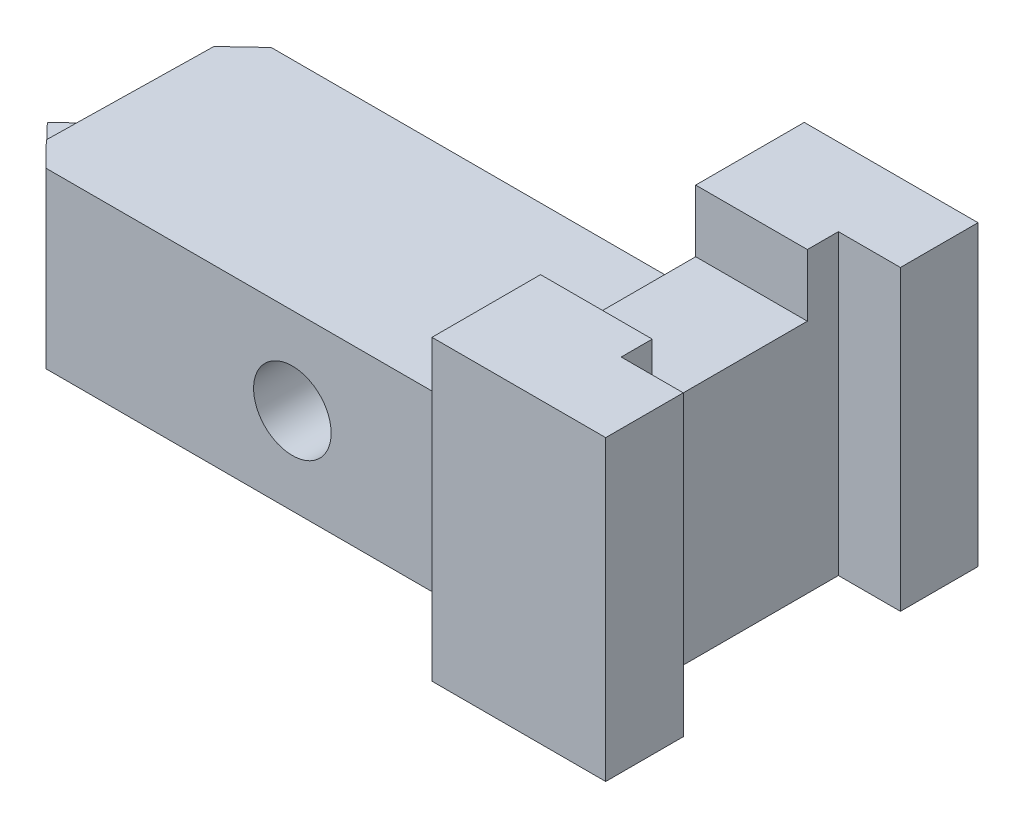
from build123d import *

# Parameters (mm, degrees)
SKETCH1_W           = 28
SKETCH1_H           = 48
BOSS_EXTRUDE3_DEPTH = 60
SKETCH6_W           = 10
SKETCH6_H           = 35
CUT_EXTRUDE7_DEPTH  = 48
SKETCH7_W           = 25
SKETCH7_H           = 10
CUT_EXTRUDE8_DEPTH  = 48
SKETCH8_W           = 35
SKETCH8_H           = 28
BOSS_EXTRUDE4_DEPTH = 92
SKETCH9_R           = 6.25
CUT_EXTRUDE9_DEPTH  = 59
CUT_EXTRUDE12_DEPTH = 59
CUT_EXTRUDE13_DEPTH = 59
CUT_EXTRUDE18_DEPTH = 11


with BuildPart() as part:
    # Sketch1 → Boss-Extrude3 (new body)
    with BuildSketch(Plane.XY):
        with Locations((14, 24)):
            Rectangle(SKETCH1_W, SKETCH1_H)
    extrude(amount=BOSS_EXTRUDE3_DEPTH)

    # Sketch6 → Cut-Extrude7 (cut)
    with BuildSketch(Plane(origin=(0, 48, 0), x_dir=(1, 0, 0), z_dir=(0, 1, 0))):
        with Locations((23, -30)):
            Rectangle(SKETCH6_W, SKETCH6_H)
    extrude(amount=-CUT_EXTRUDE7_DEPTH, mode=Mode.SUBTRACT)

    # Sketch7 → Cut-Extrude8 (cut)
    with BuildSketch(Plane.ZY):
        with Locations((30, 43)):
            Rectangle(SKETCH7_W, SKETCH7_H)
    extrude(amount=-CUT_EXTRUDE8_DEPTH, mode=Mode.SUBTRACT)

    # Sketch8 → Boss-Extrude4 (add)
    with BuildSketch(Plane.ZY):
        with Locations((30, 14)):
            Rectangle(SKETCH8_W, SKETCH8_H)
    extrude(amount=BOSS_EXTRUDE4_DEPTH)

    # Sketch9 → Cut-Extrude9 (cut)
    with BuildSketch(Plane.XY.offset(47.5)):
        with Locations((-35, 14)):
            Circle(SKETCH9_R)
    extrude(amount=-CUT_EXTRUDE9_DEPTH, mode=Mode.SUBTRACT)

    # Sketch16 → Cut-Extrude12 (cut)
    with BuildSketch(Plane(origin=(0, 28, 0), x_dir=(1, 0, 0), z_dir=(0, 1, 0))):
        Polygon((-92, -30), (-73.408450704, -12.5), (-92, -12.5), align=None)
    extrude(amount=-CUT_EXTRUDE12_DEPTH, mode=Mode.SUBTRACT)

    # Sketch17 → Cut-Extrude13 (cut)
    with BuildSketch(Plane(origin=(0, 28, 0), x_dir=(1, 0, 0), z_dir=(0, 1, 0))):
        Polygon((-92, -30), (-92, -47.5), (-74.705382998, -47.5), align=None)
    extrude(amount=-CUT_EXTRUDE13_DEPTH, mode=Mode.SUBTRACT)

    # Sketch18 → Cut-Extrude18 (cut)
    with BuildSketch(Plane(origin=(0, 28, 0), x_dir=(1, 0, 0), z_dir=(0, 1, 0))):
        Polygon((-92, -30), (-78.644507081, -43.514096673), (-78.164969417, -16.977253409), align=None)
    extrude(amount=-CUT_EXTRUDE18_DEPTH, mode=Mode.SUBTRACT)


solid = part.part
